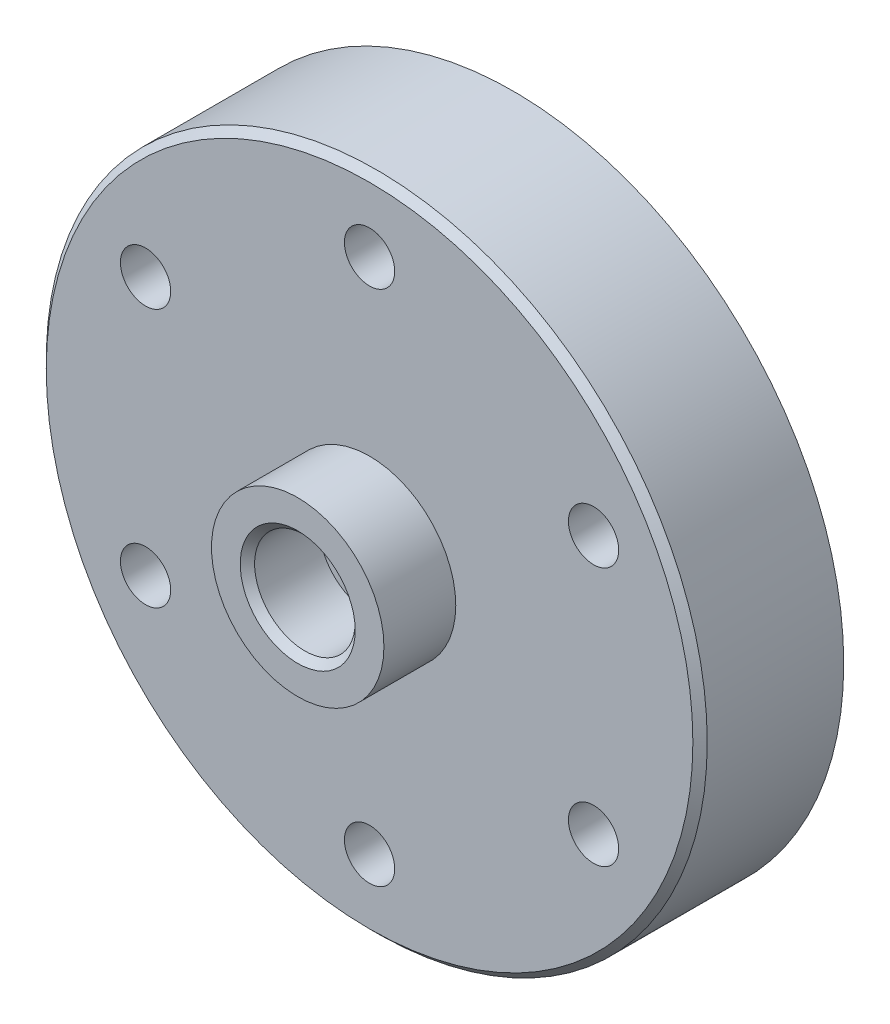
from build123d import *

# Parameters (mm, degrees)
SKETCH1_R           = 46
SKETCH1_R_2         = 3.5
BOSS_EXTRUDE1_DEPTH = 20
CHAMFER1_SIZE       = 1
SKETCH2_R           = 12
BOSS_EXTRUDE2_DEPTH = 10
SKETCH3_R           = 33
CUT_EXTRUDE1_DEPTH  = 14
SKETCH4_R           = 2.5
CUT_EXTRUDE2_DEPTH  = 6
SKETCH5_R           = 7
CUT_EXTRUDE3_DEPTH  = 10
CHAMFER2_SIZE       = 1
SKETCH6_R           = 4
CUT_EXTRUDE4_DEPTH  = 80


with BuildPart() as part:
    # Sketch1 → Boss-Extrude1 (new body)
    with BuildSketch(Plane.XY):
        Circle(SKETCH1_R)
        with Locations((0, 36)):
            Circle(SKETCH1_R_2, mode=Mode.SUBTRACT)
        with Locations((31.176914536, 18)):
            Circle(SKETCH1_R_2, mode=Mode.SUBTRACT)
        with Locations((31.176914536, -18)):
            Circle(SKETCH1_R_2, mode=Mode.SUBTRACT)
        with Locations((0, -36)):
            Circle(SKETCH1_R_2, mode=Mode.SUBTRACT)
        with Locations((-31.176914536, -18)):
            Circle(SKETCH1_R_2, mode=Mode.SUBTRACT)
        with Locations((-31.176914536, 18)):
            Circle(SKETCH1_R_2, mode=Mode.SUBTRACT)
    extrude(amount=BOSS_EXTRUDE1_DEPTH)

    # Chamfer1
    chamfer1_edges = [part.edges().sort_by_distance(p)[0] for p in [
        (-46, 0, 20),
    ]]
    chamfer(chamfer1_edges, length=CHAMFER1_SIZE)

    # Sketch2 → Boss-Extrude2 (add)
    with BuildSketch(Plane.XY.offset(20)):
        Circle(SKETCH2_R)
    extrude(amount=BOSS_EXTRUDE2_DEPTH)

    # Sketch3 → Cut-Extrude1 (cut)
    with BuildSketch(Plane(origin=(0, 0, 0), x_dir=(-1, 0, 0), z_dir=(0, 0, -1))):
        Circle(SKETCH3_R)
    extrude(amount=-CUT_EXTRUDE1_DEPTH, mode=Mode.SUBTRACT)

    # Sketch4 → Cut-Extrude2 (cut)
    with BuildSketch(Plane(origin=(0, 0, 14), x_dir=(-1, 0, 0), z_dir=(0, 0, -1))):
        Circle(SKETCH4_R)
    extrude(amount=-CUT_EXTRUDE2_DEPTH, mode=Mode.SUBTRACT)

    # Sketch5 → Cut-Extrude3 (cut)
    with BuildSketch(Plane.XY.offset(30)):
        Circle(SKETCH5_R)
    extrude(amount=-CUT_EXTRUDE3_DEPTH, mode=Mode.SUBTRACT)

    # Chamfer2
    chamfer2_edges = [part.edges().sort_by_distance(p)[0] for p in [
        (-7, 0, 30),
    ]]
    chamfer(chamfer2_edges, length=CHAMFER2_SIZE)

    # Sketch6 → Cut-Extrude4 (cut)
    with BuildSketch(Plane(origin=(0, 0, 0), x_dir=(0, 0, -1), z_dir=(1, 0, 0))):
        with Locations((-8, 0)):
            Circle(SKETCH6_R)
    extrude(amount=-CUT_EXTRUDE4_DEPTH, mode=Mode.SUBTRACT)


solid = part.part
